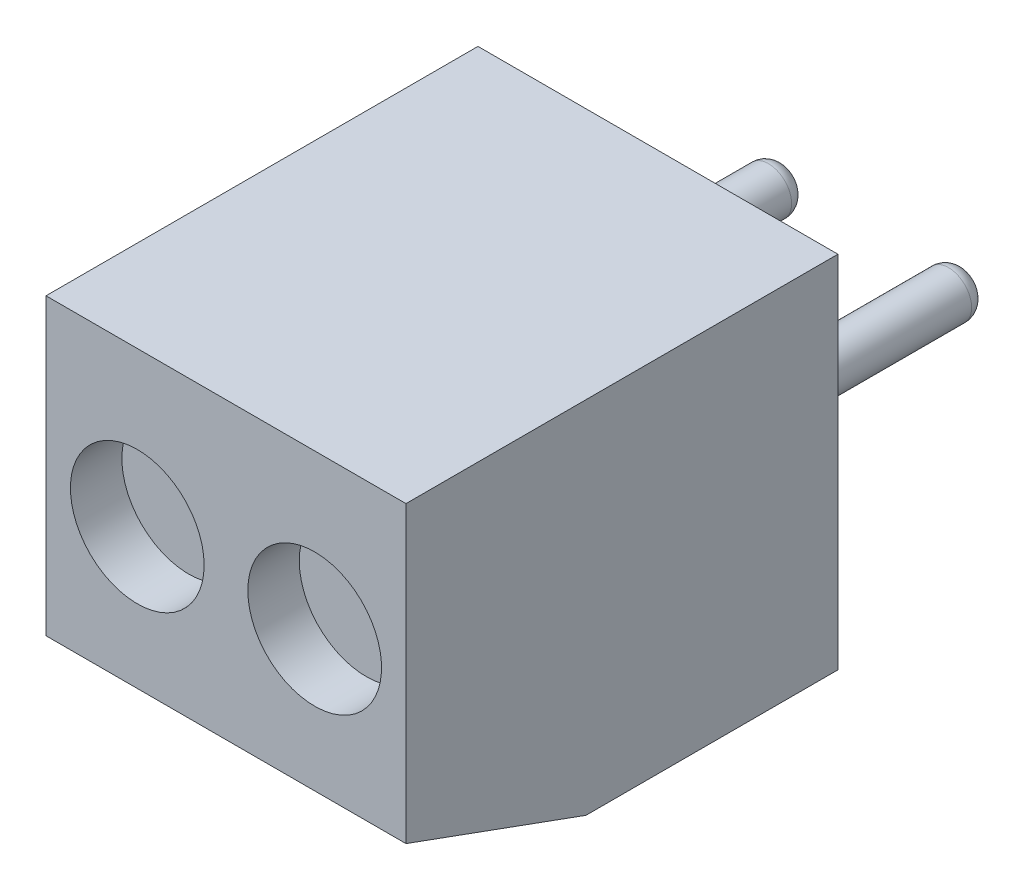
from build123d import *

# Parameters (mm, degrees)
SKETCH1_W           = 7
SKETCH1_H           = 7
BOSS_EXTRUDE1_DEPTH = 8.4
CHAMFER1_SIZE       = 3.5
CHAMFER1_SIZE2      = 1.27389582
SKETCH2_W           = 2.85
SKETCH2_H           = 4.2
CUT_EXTRUDE1_DEPTH  = 1.8
SKETCH3_R           = 1
CUT_EXTRUDE2_DEPTH  = 4.2
SKETCH4_R           = 1.3
CUT_EXTRUDE3_DEPTH  = 1
SKETCH5_R           = 0.45
BOSS_EXTRUDE2_DEPTH = 4.2
FILLET1_R           = 0.3


with BuildPart() as part:
    # Sketch1 → Boss-Extrude1 (new body)
    with BuildSketch(Plane.XY):
        Rectangle(SKETCH1_W, SKETCH1_H)
    extrude(amount=BOSS_EXTRUDE1_DEPTH)

    # Chamfer1
    chamfer1_edges = [part.edges().sort_by_distance(p)[0] for p in [
        (0, -3.5, 8.4),
    ]]
    chamfer1_side = [part.faces().sort_by_distance(p)[0] for p in [
        (0, -3.5, 4.2),
    ]]
    chamfer(chamfer1_edges, length=CHAMFER1_SIZE, length2=CHAMFER1_SIZE2, reference=chamfer1_side[0])

    # Sketch2 → Cut-Extrude1 (cut)
    with BuildSketch(Plane.XZ.offset(3.5)):
        with Locations((1.725, 2.6)):
            Rectangle(SKETCH2_W, SKETCH2_H)
        with Locations((-1.725, 2.6)):
            Rectangle(SKETCH2_W, SKETCH2_H)
    extrude(amount=-CUT_EXTRUDE1_DEPTH, mode=Mode.SUBTRACT)

    # Sketch3 → Cut-Extrude2 (cut)
    with BuildSketch(Plane.XZ.offset(1.7)):
        with Locations(Location((-1.725, 2.6, 0), (0, 0, 270))):
            Circle(SKETCH3_R)
        with Locations(Location((1.725, 2.6, 0), (0, 0, 270))):
            Circle(SKETCH3_R)
    extrude(amount=-CUT_EXTRUDE2_DEPTH, mode=Mode.SUBTRACT)

    # Sketch4 → Cut-Extrude3 (cut)
    with BuildSketch(Plane.XY.offset(8.4)):
        with Locations((-1.725, 0.5)):
            Circle(SKETCH4_R)
        with Locations(Location((1.725, 0.5, 0), (0, 0, 180))):
            Circle(SKETCH4_R)
    extrude(amount=-CUT_EXTRUDE3_DEPTH, mode=Mode.SUBTRACT)

    # Sketch5 → Boss-Extrude2 (add)
    with BuildSketch(Plane(origin=(0, 0, 0), x_dir=(-1, 0, 0), z_dir=(0, 0, -1))):
        with Locations((-1.75, 0)):
            Circle(SKETCH5_R)
        with Locations(Location((1.75, 0, 0), (0, 0, 180))):
            Circle(SKETCH5_R)
    extrude(amount=BOSS_EXTRUDE2_DEPTH)

    # Fillet1
    fillet1_edges = [part.edges().sort_by_distance(p)[0] for p in [
        (2.2, 0, -4.2),
        (-2.2, 0, -4.2),
    ]]
    fillet(fillet1_edges, radius=FILLET1_R)


solid = part.part
